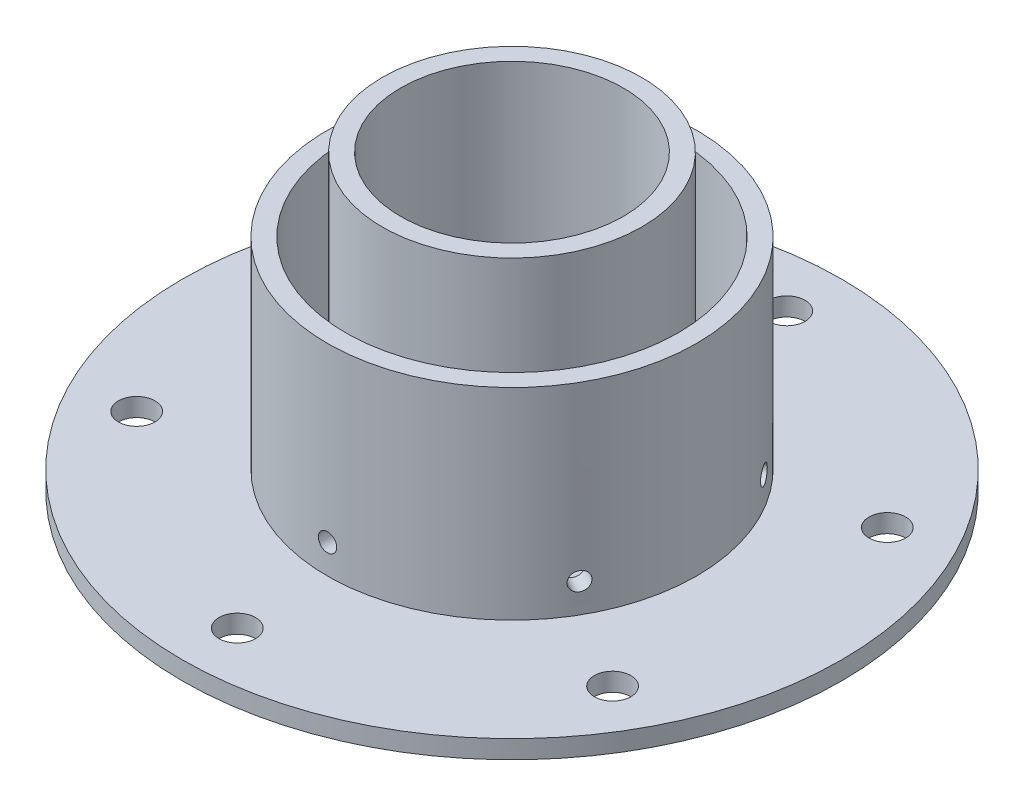
from build123d import *

# Parameters (mm, degrees)
CUT_EXTRUDE1_START = 25.4
SKETCH2_R          = 1.5875
CUT_EXTRUDE1_DEPTH = 32.512
CIRPATTERN1_COUNT  = 6
SKETCH3_R          = 3.175
CUT_EXTRUDE2_DEPTH = 50.8
CIRPATTERN2_COUNT  = 6


with BuildPart() as part:
    # Sketch1 → Revolve1 (revolve)
    with BuildSketch(Plane.XY, mode=Mode.PRIVATE) as revolve1_sk:
        Polygon((-12.7, 3.175), (-12.7, 38.1), (-9.525, 38.1), (-9.525, 3.175), (-3.175, 3.175), (-3.175, 50.8), (0, 50.8), (0, 0), (-37.846, 0), (-37.846, 3.175), align=None)
    revolve(revolve1_sk.sketch.rotate(Axis((19.304, 0, 0), (0, 1, 0)), 180), axis=Axis((19.304, 0, 0), (0, 1, 0)))

    # Sketch2 → Cut-Extrude1 (cut)
    with BuildSketch(Plane.XY.offset(CUT_EXTRUDE1_START)):
        with Locations(Location((19.304, 8.255, 0), (0, 0, 180))):
            Circle(SKETCH2_R)
    cut_extrude1 = extrude(amount=CUT_EXTRUDE1_DEPTH, mode=Mode.SUBTRACT)

    # CirPattern1: Cut-Extrude1 ×6 about axis
    cirpattern1_axis = Axis((19.304, 0, 0), (0, -1, 0))
    for i in range(1, CIRPATTERN1_COUNT):
        add(cut_extrude1.rotate(cirpattern1_axis, i * 360 / CIRPATTERN1_COUNT), mode=Mode.SUBTRACT)

    # Sketch3 → Cut-Extrude2 (cut)
    with BuildSketch(Plane(origin=(0, 3.175, 0), x_dir=(1, 0, 0), z_dir=(0, 1, 0))):
        with Locations(Location((-21.940459855, 23.8125, 0), (0, 0, 180))):
            Circle(SKETCH3_R)
    cut_extrude2 = extrude(amount=-CUT_EXTRUDE2_DEPTH, mode=Mode.SUBTRACT)

    # CirPattern2: Cut-Extrude2 ×6 about axis
    cirpattern2_axis = Axis((19.304, 0, 0), (0, 1, 0))
    for i in range(1, CIRPATTERN2_COUNT):
        add(cut_extrude2.rotate(cirpattern2_axis, i * 360 / CIRPATTERN2_COUNT), mode=Mode.SUBTRACT)


solid = part.part
